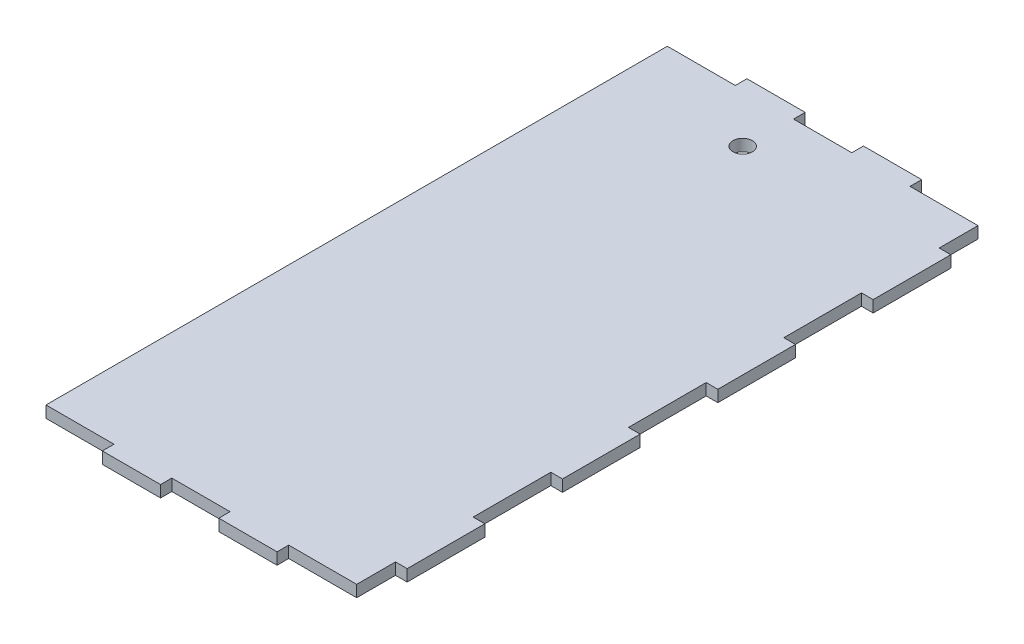
from build123d import *

# Parameters (mm, degrees)
CROQUIS1_R              = 2.5
SALIENTE_EXTRUIR1_DEPTH = 3


with BuildPart() as part:
    # Croquis1 → Saliente-Extruir1 (new body)
    with BuildSketch(Plane(origin=(0, 0, 0), x_dir=(1, 0, 0), z_dir=(0, 1, 0))):
        Polygon((23, 3), (38, 3), (38, 5.896935859), (53, 5.896935859), (53, 3), (68, 3), (68, 6), (85.5, 6), (85.5, 16), (88.5, 16), (88.5, 36), (85.5, 36), (85.5, 56), (88.5, 56), (88.5, 76), (85.5, 76), (85.5, 96), (88.5, 96), (88.5, 116), (85.5, 116), (85.5, 136), (88.5, 136), (88.5, 156), (85.5, 156), (85.5, 166), (68, 166), (68, 169), (53, 169), (53, 166), (38, 166), (38, 169), (23, 169), (23, 166), (5.5, 166), (5.5, 153), (5.5, 13), (5.5, 6), (23, 6), align=None)
        with Locations(Location((37.5, 153.396935859, 0), (0, 0, 270))):
            Circle(CROQUIS1_R, mode=Mode.SUBTRACT)
    extrude(amount=SALIENTE_EXTRUIR1_DEPTH)


solid = part.part
